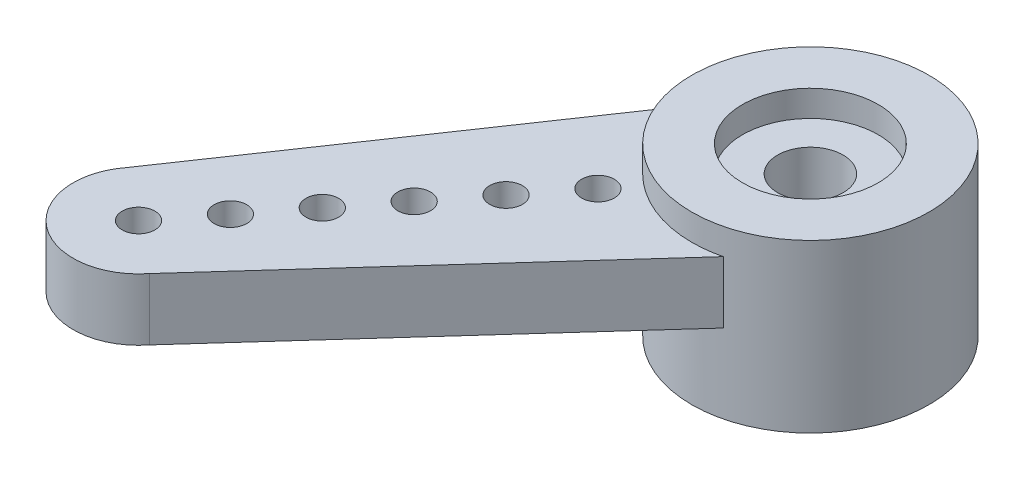
from build123d import *

# Parameters (mm, degrees)
SKETCH1_R           = 3.625
SKETCH1_R_2         = 2.075
BOSS_EXTRUDE1_DEPTH = 2.41
SKETCH2_R           = 1
SKETCH2_R_2         = 0.5
BOSS_EXTRUDE3_DEPTH = 1.89
BOSS_EXTRUDE4_START = 4.3
SKETCH1_2_R         = 3.625
SKETCH1_2_R_2       = 2.075
BOSS_EXTRUDE4_DEPTH = 0.8


with BuildPart() as part:
    # Sketch1 → Boss-Extrude1 (new body)
    with BuildSketch(Plane(origin=(0, 0, 0), x_dir=(1, 0, 0), z_dir=(0, 1, 0))):
        with Locations(Location((0, 0, 0), (0, 0, 270))):
            Circle(SKETCH1_R)
        with Locations(Location((0, 0, 0), (0, 0, 270))):
            Circle(SKETCH1_R_2, mode=Mode.SUBTRACT)
    extrude(amount=BOSS_EXTRUDE1_DEPTH)

    # Sketch2 → Boss-Extrude3 (add)
    with BuildSketch(Plane(origin=(0, 2.41, 0), x_dir=(1, 0, 0), z_dir=(0, 1, 0))):
        with BuildLine():
            Line((-10.6054557, -10.267177528), (-3.625, 0))
            ThreePointArc((-3.625, 0), (2.238819707, 2.851019347), (0.859585555, -3.521610097))
            Line((0.859585555, -3.521610097), (-7.459503317, -12.737599274))
            ThreePointArc((-7.459503317, -12.737599274), (-10.267690381, -13.075364593), (-10.6054557, -10.267177528))
        make_face()
        with Locations(Location((0, 0, 0), (0, 0, 270))):
            Circle(SKETCH2_R, mode=Mode.SUBTRACT)
        with Locations(Location((-9.032479508, -11.502388401, 0), (0, 0, 270))):
            Circle(SKETCH2_R_2, mode=Mode.SUBTRACT)
        with Locations(Location((-7.797268635, -9.92941221, 0), (0, 0, 270))):
            Circle(SKETCH2_R_2, mode=Mode.SUBTRACT)
        with Locations(Location((-6.562057762, -8.356436018, 0), (0, 0, 270))):
            Circle(SKETCH2_R_2, mode=Mode.SUBTRACT)
        with Locations(Location((-5.32684689, -6.783459826, 0), (0, 0, 270))):
            Circle(SKETCH2_R_2, mode=Mode.SUBTRACT)
        with Locations(Location((-4.091636017, -5.210483635, 0), (0, 0, 270))):
            Circle(SKETCH2_R_2, mode=Mode.SUBTRACT)
        with Locations(Location((-2.856425144, -3.637507443, 0), (0, 0, 270))):
            Circle(SKETCH2_R_2, mode=Mode.SUBTRACT)
    extrude(amount=BOSS_EXTRUDE3_DEPTH)

    # Sketch1<2> → Boss-Extrude4 (add)
    with BuildSketch(Plane(origin=(0, 0, 0), x_dir=(1, 0, 0), z_dir=(0, 1, 0)).offset(BOSS_EXTRUDE4_START)):
        with Locations(Location((0, 0, 0), (0, 0, 270))):
            Circle(SKETCH1_2_R)
        with Locations(Location((0, 0, 0), (0, 0, 270))):
            Circle(SKETCH1_2_R_2, mode=Mode.SUBTRACT)
    extrude(amount=BOSS_EXTRUDE4_DEPTH)


solid = part.part
